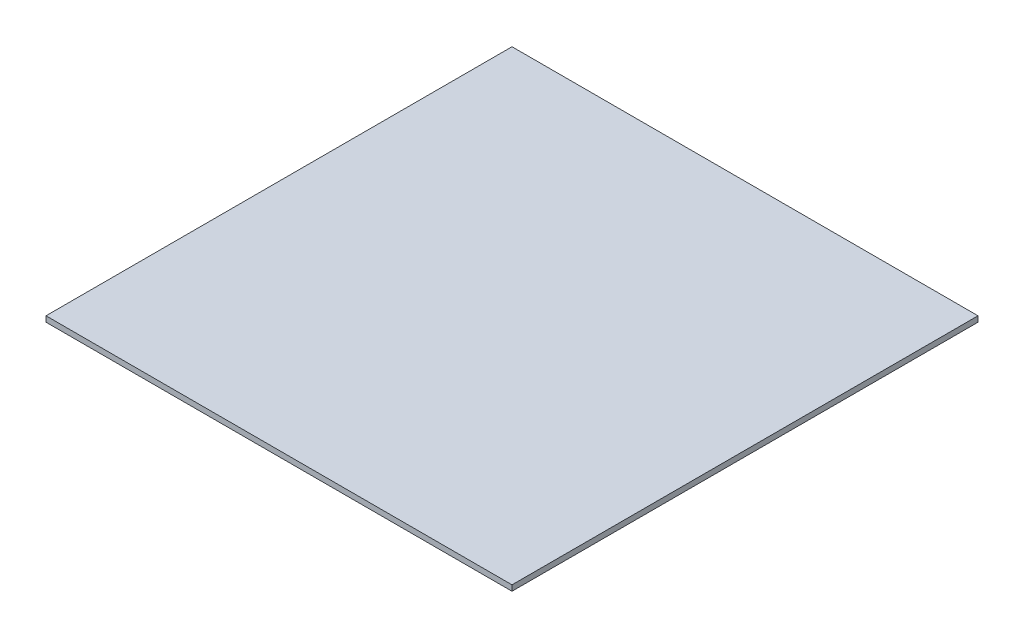
from build123d import *

# Parameters (mm, degrees)
CROQUIS1_W              = 100
CROQUIS1_H              = 100
SALIENTE_EXTRUIR1_DEPTH = 1.2


with BuildPart() as part:
    # Croquis1 → Saliente-Extruir1 (new body)
    with BuildSketch(Plane(origin=(0, 0, 0), x_dir=(1, 0, 0), z_dir=(0, 1, 0))):
        with Locations((50, 50)):
            Rectangle(CROQUIS1_W, CROQUIS1_H)
    extrude(amount=SALIENTE_EXTRUIR1_DEPTH)


solid = part.part
